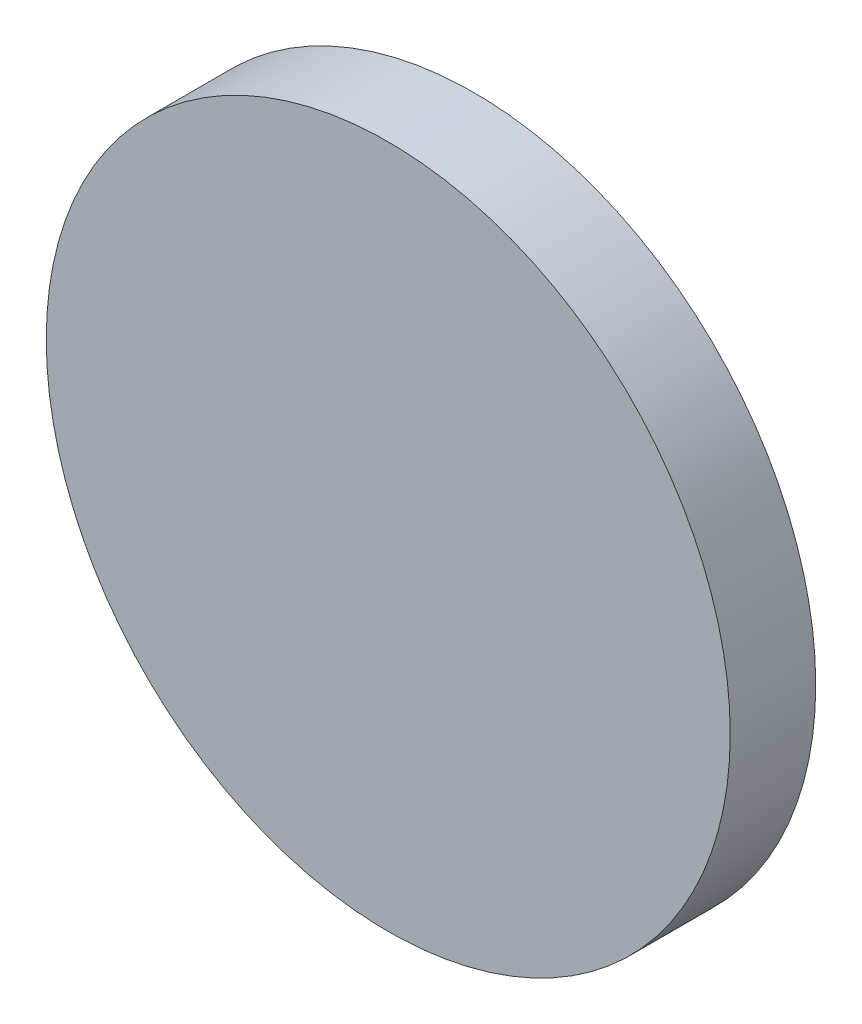
from build123d import *

# Parameters (mm, degrees)
SKETCH1_R           = 8
BOSS_EXTRUDE1_DEPTH = 2


with BuildPart() as part:
    # Sketch1 → Boss-Extrude1 (new body)
    with BuildSketch(Plane.XY):
        with Locations((-31.455987614, 78.010802305)):
            Circle(SKETCH1_R)
    extrude(amount=BOSS_EXTRUDE1_DEPTH)


solid = part.part
